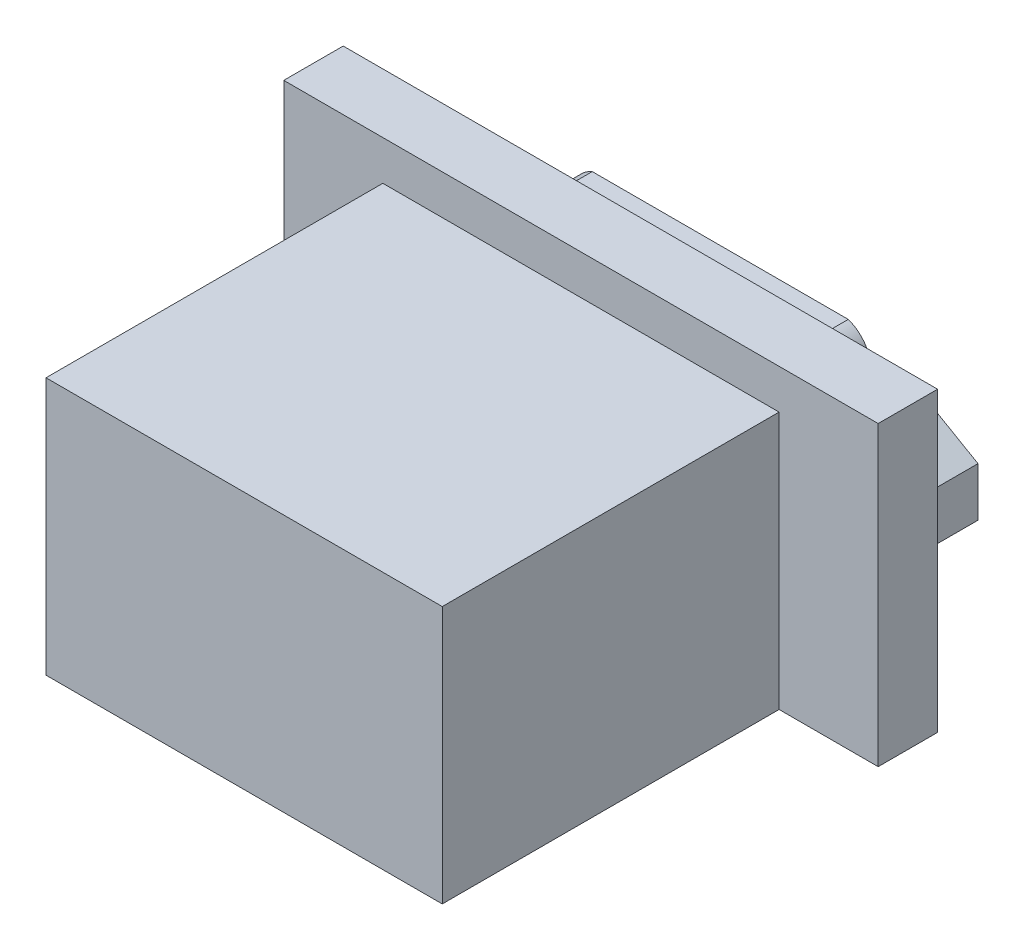
from build123d import *

# Parameters (mm, degrees)
SKETCH1_W           = 30
SKETCH1_H           = 20
BOSS_EXTRUDE1_DEPTH = 15
SKETCH2_W           = 5
SKETCH2_H           = 15
CUT_EXTRUDE4_DEPTH  = 17
SKETCH3_W           = 20
SKETCH3_H           = 2
CUT_EXTRUDE5_DEPTH  = 17
BOSS_EXTRUDE3_DEPTH = 4
BOSS_EXTRUDE4_DEPTH = 4
SKETCH8_R           = 1.579197179
SKETCH8_R_2         = 1.58
CUT_EXTRUDE8_DEPTH  = 4
CUT_EXTRUDE12_DEPTH = 4
SKETCH10_R          = 0.75
BOSS_EXTRUDE5_DEPTH = 3


with BuildPart() as part:
    # Sketch1 → Boss-Extrude1 (new body)
    with BuildSketch(Plane(origin=(0, 0, 0), x_dir=(1, 0, 0), z_dir=(0, 1, 0))):
        with Locations((15, 10)):
            Rectangle(SKETCH1_W, SKETCH1_H)
    extrude(amount=BOSS_EXTRUDE1_DEPTH)

    # Sketch2 → Cut-Extrude4 (cut)
    with BuildSketch(Plane.XY):
        with Locations((27.5, 7.5)):
            Rectangle(SKETCH2_W, SKETCH2_H)
        with Locations((2.5, 7.5)):
            Rectangle(SKETCH2_W, SKETCH2_H)
    extrude(amount=-CUT_EXTRUDE4_DEPTH, mode=Mode.SUBTRACT)

    # Sketch3 → Cut-Extrude5 (cut)
    with BuildSketch(Plane.XY):
        with Locations((15, 14)):
            Rectangle(SKETCH3_W, SKETCH3_H)
    extrude(amount=-CUT_EXTRUDE5_DEPTH, mode=Mode.SUBTRACT)

    # Sketch6 → Boss-Extrude3 (add)
    with BuildSketch(Plane(origin=(0, 0, -20), x_dir=(-1, 0, 0), z_dir=(0, 0, -1))):
        with BuildLine():
            Line((-8.569503225, 11.796579234), (-21.490222751, 11.796579234))
            ThreePointArc((-21.490222751, 11.796579234), (-22.407058542, 11.036037401), (-22.599660768, 9.860488113))
            Line((-22.599660768, 9.860488113), (-21.315495161, 3.650100945))
            ThreePointArc((-21.315495161, 3.650100945), (-20.823120618, 3.032864625), (-20.069739851, 2.796579234))
            Line((-20.069739851, 2.796579234), (-10.84314976, 2.796579234))
            ThreePointArc((-10.84314976, 2.796579234), (-10.281938841, 3.044467569), (-9.88839036, 3.515132967))
            Line((-9.88839036, 3.515132967), (-7.531107534, 10.273814665))
            ThreePointArc((-7.531107534, 10.273814665), (-7.826028971, 11.188134351), (-8.569503225, 11.796579234))
        make_face()
    extrude(amount=BOSS_EXTRUDE3_DEPTH)

    # Sketch7 → Boss-Extrude4 (add)
    with BuildSketch(Plane(origin=(0, 0, -20), x_dir=(-1, 0, 0), z_dir=(0, 0, -1))):
        Polygon((-3.985927745, 10.00319824), (-6.12825709, 8.766323815), (-6.12825709, 6.292574967), (-3.985927745, 5.055700542), (-1.843598399, 6.292574967), (-1.843598399, 8.766323815), align=None)
        Polygon((-25.896274691, 10.00319824), (-28.038604037, 8.766323815), (-28.038604037, 6.292574967), (-25.896274691, 5.055700542), (-23.753945346, 6.292574967), (-23.753945346, 8.766323815), align=None)
    extrude(amount=BOSS_EXTRUDE4_DEPTH)

    # Sketch8 → Cut-Extrude8 (cut)
    with BuildSketch(Plane(origin=(0, 0, -24), x_dir=(-1, 0, 0), z_dir=(0, 0, -1))):
        with Locations((-25.949762311, 7.480091341)):
            Circle(SKETCH8_R)
        with Locations((-4.010420372, 7.480091341)):
            Circle(SKETCH8_R_2)
    extrude(amount=-CUT_EXTRUDE8_DEPTH, mode=Mode.SUBTRACT)

    # Sketch9 → Cut-Extrude12 (cut)
    with BuildSketch(Plane(origin=(0, 0, -24), x_dir=(-1, 0, 0), z_dir=(0, 0, -1))):
        Polygon((-8.748681153, 10.506207471), (-21.331387013, 10.48502632), (-20.043360928, 3.411896064), (-11.018349356, 3.427088355), align=None)
    extrude(amount=-CUT_EXTRUDE12_DEPTH, mode=Mode.SUBTRACT)

    # Sketch10 → Boss-Extrude5 (add)
    with BuildSketch(Plane(origin=(0, 0, -20), x_dir=(-1, 0, 0), z_dir=(0, 0, -1))):
        with Locations(Location((-10.699729711, 9.112601358, 0), (0, 0, 180))):
            Circle(SKETCH10_R)
        with Locations(Location((-11.814614601, 6.843014261, 0), (0, 0, 180))):
            Circle(SKETCH10_R)
        with Locations(Location((-12.699729711, 9.112601358, 0), (0, 0, 180))):
            Circle(SKETCH10_R)
        with Locations(Location((-13.814614601, 6.843014261, 0), (0, 0, 180))):
            Circle(SKETCH10_R)
        with Locations(Location((-14.699729711, 9.112601358, 0), (0, 0, 180))):
            Circle(SKETCH10_R)
        with Locations(Location((-15.814614601, 6.843014261, 0), (0, 0, 180))):
            Circle(SKETCH10_R)
        with Locations(Location((-16.699729711, 9.112601358, 0), (0, 0, 180))):
            Circle(SKETCH10_R)
        with Locations(Location((-17.814614601, 6.843014261, 0), (0, 0, 180))):
            Circle(SKETCH10_R)
        with Locations(Location((-18.699729711, 9.112601358, 0), (0, 0, 180))):
            Circle(SKETCH10_R)
        with Locations(Location((-19.814614601, 6.843014261, 0), (0, 0, 180))):
            Circle(SKETCH10_R)
    extrude(amount=BOSS_EXTRUDE5_DEPTH)


solid = part.part
